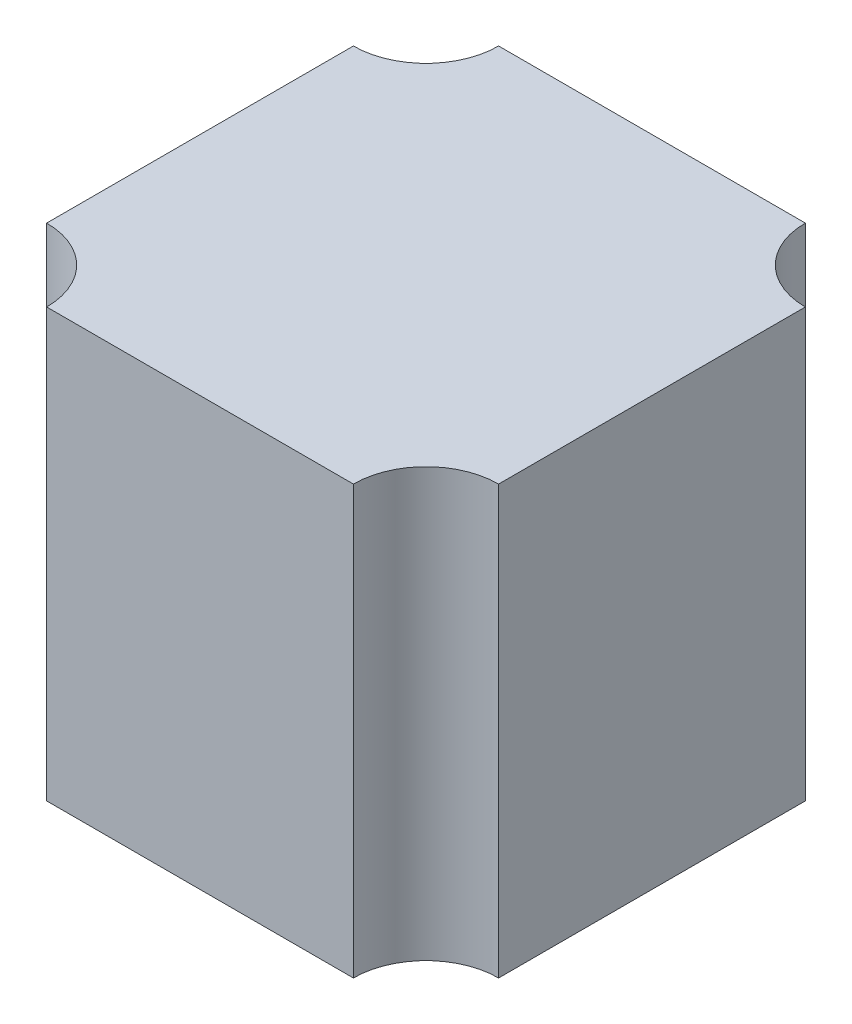
from build123d import *

# Parameters (mm, degrees)
BOSS_EXTRUDE1_DEPTH = 53


with BuildPart() as part:
    # Sketch1 → Boss-Extrude1 (new body)
    with BuildSketch(Plane(origin=(0, 0, 0), x_dir=(1, 0, 0), z_dir=(0, 1, 0))):
        with BuildLine():
            Line((-19, 28), (19, 28))
            ThreePointArc((19, 28), (21.636038969, 21.636038969), (28, 19))
            Line((28, 19), (28, -19))
            ThreePointArc((28, -19), (21.636038969, -21.636038969), (19, -28))
            Line((19, -28), (-19, -28))
            ThreePointArc((-19, -28), (-21.636038969, -21.636038969), (-28, -19))
            Line((-28, -19), (-28, 19))
            ThreePointArc((-28, 19), (-21.636038969, 21.636038969), (-19, 28))
        make_face()
    extrude(amount=BOSS_EXTRUDE1_DEPTH)


solid = part.part
